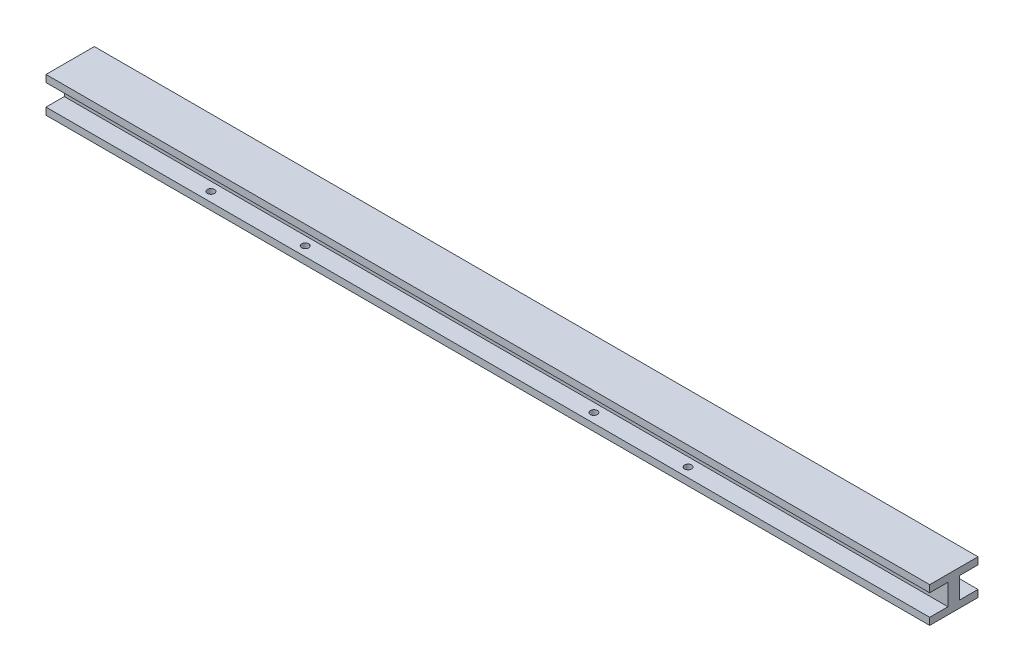
from build123d import *

# Parameters (mm, degrees)
BOSS_EXTRUDE1_DEPTH            = 1500
CUT_EXTRUDE1_REACH             = 1505.437
SKETCH4_R                      = 6
CUT_EXTRUDE1_DIRECTION_2_DEPTH = 1504.437394772


with BuildPart() as part:
    # Sketch1 → Boss-Extrude1 (new body)
    with BuildSketch(Plane(origin=(0, 0, 0), x_dir=(0, 0, -1), z_dir=(1, 0, 0))):
        Polygon((51, -12), (82, -12), (82, 0), (0, 0), (0, -12), (31, -12), (31, -48), (0, -48), (0, -60), (82, -60), (82, -48), (51, -48), align=None)
    extrude(amount=BOSS_EXTRUDE1_DEPTH)

    # Sketch4 → Cut-Extrude1 (cut, up to next)
    with BuildSketch(Plane(origin=(0, -60, 0), x_dir=(-1, 0, 0), z_dir=(0, -1, 0)), mode=Mode.PRIVATE) as cut_extrude1_sk1:
        with Locations(Location((-424, 16, 0), (0, 0, 270))):
            Circle(SKETCH4_R)
    cut_extrude1_tool1 = extrude(cut_extrude1_sk1.sketch, amount=-CUT_EXTRUDE1_REACH, mode=Mode.PRIVATE) & part.part
    # Sketch4 → Cut-Extrude1 (cut, up to next)
    with BuildSketch(Plane(origin=(0, -60, 0), x_dir=(-1, 0, 0), z_dir=(0, -1, 0)), mode=Mode.PRIVATE) as cut_extrude1_sk2:
        with Locations(Location((-424, 66, 0), (0, 0, 270))):
            Circle(SKETCH4_R)
    cut_extrude1_tool2 = extrude(cut_extrude1_sk2.sketch, amount=-CUT_EXTRUDE1_REACH, mode=Mode.PRIVATE) & part.part
    # Sketch4 → Cut-Extrude1 (cut, up to next)
    with BuildSketch(Plane(origin=(0, -60, 0), x_dir=(-1, 0, 0), z_dir=(0, -1, 0)), mode=Mode.PRIVATE) as cut_extrude1_sk3:
        with Locations(Location((-264, 66, 0), (0, 0, 270))):
            Circle(SKETCH4_R)
    cut_extrude1_tool3 = extrude(cut_extrude1_sk3.sketch, amount=-CUT_EXTRUDE1_REACH, mode=Mode.PRIVATE) & part.part
    # Sketch4 → Cut-Extrude1 (cut, up to next)
    with BuildSketch(Plane(origin=(0, -60, 0), x_dir=(-1, 0, 0), z_dir=(0, -1, 0)), mode=Mode.PRIVATE) as cut_extrude1_sk4:
        with Locations(Location((-264, 16, 0), (0, 0, 270))):
            Circle(SKETCH4_R)
    cut_extrude1_tool4 = extrude(cut_extrude1_sk4.sketch, amount=-CUT_EXTRUDE1_REACH, mode=Mode.PRIVATE) & part.part
    # Sketch4 → Cut-Extrude1 (cut, up to next)
    with BuildSketch(Plane(origin=(0, -60, 0), x_dir=(-1, 0, 0), z_dir=(0, -1, 0)), mode=Mode.PRIVATE) as cut_extrude1_sk5:
        with Locations(Location((-1074, 66, 0), (0, 0, 270))):
            Circle(SKETCH4_R)
    cut_extrude1_tool5 = extrude(cut_extrude1_sk5.sketch, amount=-CUT_EXTRUDE1_REACH, mode=Mode.PRIVATE) & part.part
    # Sketch4 → Cut-Extrude1 (cut, up to next)
    with BuildSketch(Plane(origin=(0, -60, 0), x_dir=(-1, 0, 0), z_dir=(0, -1, 0)), mode=Mode.PRIVATE) as cut_extrude1_sk6:
        with Locations(Location((-914, 66, 0), (0, 0, 270))):
            Circle(SKETCH4_R)
    cut_extrude1_tool6 = extrude(cut_extrude1_sk6.sketch, amount=-CUT_EXTRUDE1_REACH, mode=Mode.PRIVATE) & part.part
    # Sketch4 → Cut-Extrude1 (cut, up to next)
    with BuildSketch(Plane(origin=(0, -60, 0), x_dir=(-1, 0, 0), z_dir=(0, -1, 0)), mode=Mode.PRIVATE) as cut_extrude1_sk7:
        with Locations(Location((-1074, 16, 0), (0, 0, 270))):
            Circle(SKETCH4_R)
    cut_extrude1_tool7 = extrude(cut_extrude1_sk7.sketch, amount=-CUT_EXTRUDE1_REACH, mode=Mode.PRIVATE) & part.part
    # Sketch4 → Cut-Extrude1 (cut, up to next)
    with BuildSketch(Plane(origin=(0, -60, 0), x_dir=(-1, 0, 0), z_dir=(0, -1, 0)), mode=Mode.PRIVATE) as cut_extrude1_sk8:
        with Locations(Location((-914, 16, 0), (0, 0, 270))):
            Circle(SKETCH4_R)
    cut_extrude1_tool8 = extrude(cut_extrude1_sk8.sketch, amount=-CUT_EXTRUDE1_REACH, mode=Mode.PRIVATE) & part.part
    add(cut_extrude1_tool1.solids().sort_by_distance((424, -60, -16))[0], mode=Mode.SUBTRACT)
    add(cut_extrude1_tool2.solids().sort_by_distance((424, -60, -66))[0], mode=Mode.SUBTRACT)
    add(cut_extrude1_tool3.solids().sort_by_distance((264, -60, -66))[0], mode=Mode.SUBTRACT)
    add(cut_extrude1_tool4.solids().sort_by_distance((264, -60, -16))[0], mode=Mode.SUBTRACT)
    add(cut_extrude1_tool5.solids().sort_by_distance((1074, -60, -66))[0], mode=Mode.SUBTRACT)
    add(cut_extrude1_tool6.solids().sort_by_distance((914, -60, -66))[0], mode=Mode.SUBTRACT)
    add(cut_extrude1_tool7.solids().sort_by_distance((1074, -60, -16))[0], mode=Mode.SUBTRACT)
    add(cut_extrude1_tool8.solids().sort_by_distance((914, -60, -16))[0], mode=Mode.SUBTRACT)

    # Sketch4 → Cut-Extrude1 direction 2 (cut)
    with BuildSketch(Plane(origin=(0, -60, 0), x_dir=(-1, 0, 0), z_dir=(0, -1, 0))):
        with Locations(Location((-424, 16, 0), (0, 0, 270))):
            Circle(SKETCH4_R)
        with Locations(Location((-424, 66, 0), (0, 0, 270))):
            Circle(SKETCH4_R)
        with Locations(Location((-264, 66, 0), (0, 0, 270))):
            Circle(SKETCH4_R)
        with Locations(Location((-264, 16, 0), (0, 0, 270))):
            Circle(SKETCH4_R)
        with Locations(Location((-1074, 66, 0), (0, 0, 270))):
            Circle(SKETCH4_R)
        with Locations(Location((-914, 66, 0), (0, 0, 270))):
            Circle(SKETCH4_R)
        with Locations(Location((-1074, 16, 0), (0, 0, 270))):
            Circle(SKETCH4_R)
        with Locations(Location((-914, 16, 0), (0, 0, 270))):
            Circle(SKETCH4_R)
    extrude(amount=CUT_EXTRUDE1_DIRECTION_2_DEPTH, mode=Mode.SUBTRACT)


solid = part.part
